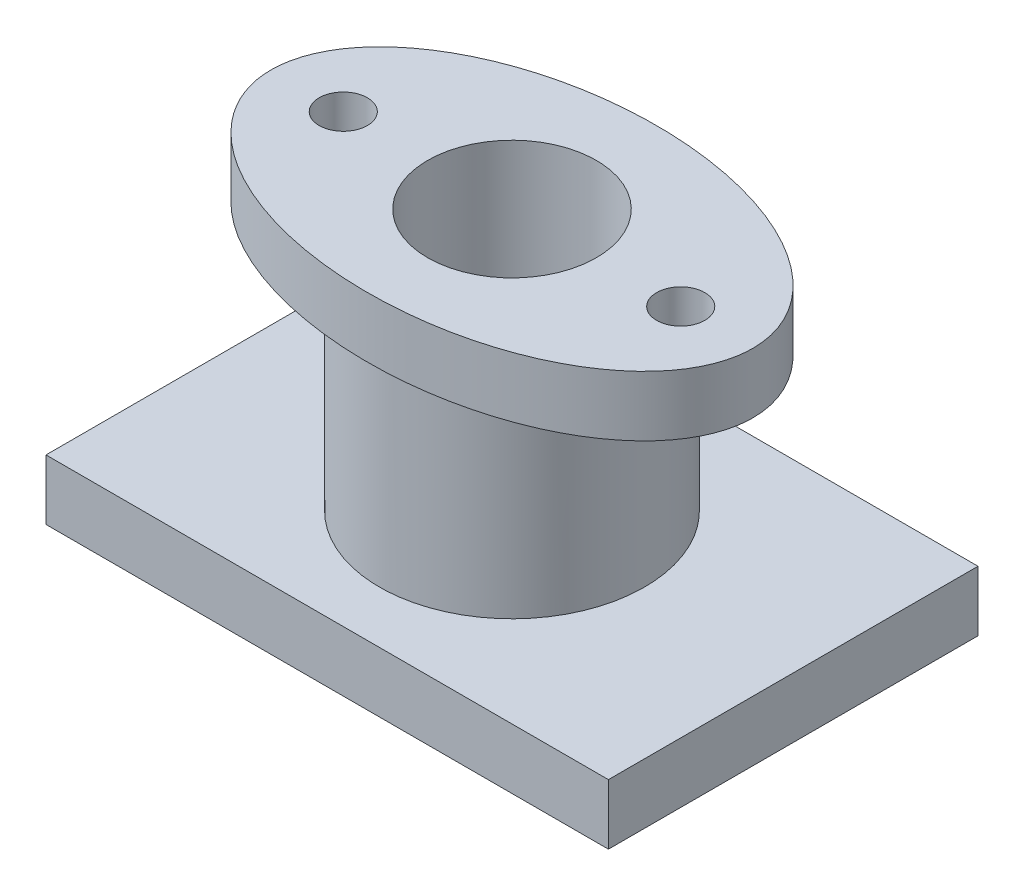
from build123d import *

# Parameters (mm, degrees)
SKETCH1_W           = 140
SKETCH1_H           = 92
SKETCH1_R           = 16.5
BOSS_EXTRUDE2_DEPTH = 15
SKETCH3_R           = 33
SKETCH3_R_2         = 21
BOSS_EXTRUDE3_DEPTH = 50
SKETCH4_RX          = 60
SKETCH4_RY          = 36
SKETCH4_R           = 6
SKETCH4_R_2         = 21
BOSS_EXTRUDE4_DEPTH = 15


with BuildPart() as part:
    # Sketch1 → Boss-Extrude2 (new body)
    with BuildSketch(Plane(origin=(0, 0, 0), x_dir=(1, 0, 0), z_dir=(0, 1, 0))):
        Rectangle(SKETCH1_W, SKETCH1_H)
        with Locations(Location((0, 0, 0), (0, 0, 270))):
            Circle(SKETCH1_R, mode=Mode.SUBTRACT)
    extrude(amount=BOSS_EXTRUDE2_DEPTH)

    # Sketch3 → Boss-Extrude3 (add)
    with BuildSketch(Plane(origin=(0, 15, 0), x_dir=(1, 0, 0), z_dir=(0, 1, 0))):
        with Locations(Location((0, 0, 0), (0, 0, 90))):
            Circle(SKETCH3_R)
        with Locations(Location((0, 0, 0), (0, 0, 270))):
            Circle(SKETCH3_R_2, mode=Mode.SUBTRACT)
    extrude(amount=BOSS_EXTRUDE3_DEPTH)

    # Sketch4 → Boss-Extrude4 (add)
    with BuildSketch(Plane(origin=(0, 65, 0), x_dir=(1, 0, 0), z_dir=(0, 1, 0))):
        with Locations((0, 0)):
            Ellipse(SKETCH4_RX, SKETCH4_RY)
        with Locations(Location((-42, 0, 0), (0, 0, 270))):
            Circle(SKETCH4_R, mode=Mode.SUBTRACT)
        with Locations(Location((42, 0, 0), (0, 0, 90))):
            Circle(SKETCH4_R, mode=Mode.SUBTRACT)
        with Locations(Location((0, 0, 0), (0, 0, 270))):
            Circle(SKETCH4_R_2, mode=Mode.SUBTRACT)
    extrude(amount=BOSS_EXTRUDE4_DEPTH)


solid = part.part
